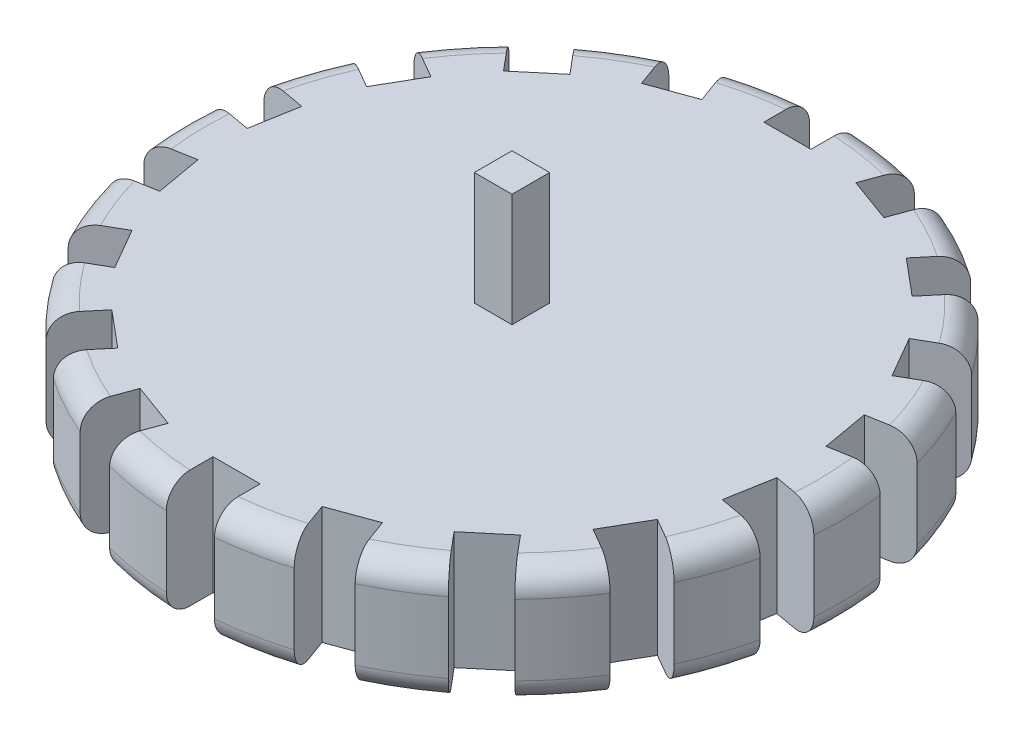
from build123d import *

# Parameters (mm, degrees)
SKETCH_1_R          = 7
EXTRUDE_1_DEPTH     = 2.5
SKETCH_2_W          = 0.8
SKETCH_2_H          = 0.8
EXTRUDE_2_DEPTH     = 2.4
SKETCH_3_R          = 1
EXTRUDE_3_DEPTH     = 1
FILLET_2_R          = 0.5
SKETCH_4_W          = 1
SKETCH_4_H          = 2
CUT_EXTRUDE_1_DEPTH = 10


with BuildPart() as part:
    # 草图1 → 凸台-拉伸1 (new body)
    with BuildSketch(Plane(origin=(0, 0, 0), x_dir=(1, 0, 0), z_dir=(0, 1, 0))):
        with Locations(Location((-28.569838241, 1.786718145, 0), (0, 0, 270))):
            Circle(SKETCH_1_R)
    extrude(amount=EXTRUDE_1_DEPTH)

    # 草图2 → 凸台-拉伸2 (add)
    with BuildSketch(Plane(origin=(0, 2.5, 0), x_dir=(1, 0, 0), z_dir=(0, 1, 0))):
        with Locations((-28.569838241, 1.786718145)):
            Rectangle(SKETCH_2_W, SKETCH_2_H)
    extrude(amount=EXTRUDE_2_DEPTH)

    # 草图3 → 凸台-拉伸3 (add)
    with BuildSketch(Plane.XZ):
        with Locations(Location((-28.569838241, -1.786718145, 0), (0, 0, 90))):
            Circle(SKETCH_3_R)
    extrude(amount=EXTRUDE_3_DEPTH)

    # 圆角2
    fillet_2_edges = [part.edges().sort_by_distance(p)[0] for p in [
        (-28.569838241, 0, -8.786718145),
        (-28.569838241, 2.5, -8.786718145),
    ]]
    fillet(fillet_2_edges, radius=FILLET_2_R)

    # 草图4 → 切除-拉伸1 (cut)
    with BuildSketch(Plane(origin=(0, 2.5, 0), x_dir=(1, 0, 0), z_dir=(0, 1, 0))):
        with Locations((-28.417730855, -5.213281855)):
            Rectangle(SKETCH_4_W, SKETCH_4_H)
        Polygon((-30.948871223, -3.732451299), (-31.632911509, -5.61183654), (-30.693218889, -5.953856683), (-30.009178602, -4.074471442), align=None)
        Polygon((-32.693065103, -2.585927453), (-33.978640322, -4.118016339), (-33.212595879, -4.760803949), (-31.927020659, -3.228715062), align=None)
        Polygon((-33.939936971, -0.911998014), (-35.671987778, -1.911998014), (-35.171987778, -2.778023418), (-33.439936971, -1.778023418), align=None)
        Polygon((-34.539095677, 1.087436422), (-36.508711183, 0.740140066), (-36.335063006, -0.244667687), (-34.3654475, 0.102628669), align=None)
        Polygon((-34.418273841, 3.171214554), (-36.387889347, 3.518510909), (-36.561537524, 2.533703156), (-34.591922018, 2.186406801), align=None)
        Polygon((-33.592044357, 5.088001986), (-35.324095165, 6.088001986), (-35.824095165, 5.221976582), (-34.092044357, 4.221976582), align=None)
        Polygon((-32.160062696, 6.606605865), (-33.445637915, 8.138694751), (-34.211682358, 7.495907141), (-32.926107139, 5.963818255), align=None)
        Polygon((-30.295046979, 7.543860151), (-30.979087266, 9.423245392), (-31.918779887, 9.081225249), (-31.2347396, 7.201840008), align=None)
        with Locations((-28.721945627, 8.786718145)):
            Rectangle(SKETCH_4_W, SKETCH_4_H)
        Polygon((-26.190805259, 7.305887588), (-25.506764973, 9.185272829), (-26.446457593, 9.527292973), (-27.13049788, 7.647907731), align=None)
        Polygon((-24.44661138, 6.159363742), (-23.16103616, 7.691452628), (-23.927080603, 8.334240238), (-25.212655823, 6.802151351), align=None)
        Polygon((-23.199739512, 4.485434303), (-21.467688704, 5.485434303), (-21.967688704, 6.351459707), (-23.699739512, 5.351459707), align=None)
        Polygon((-22.600580805, 2.485999868), (-20.630965299, 2.833296223), (-20.804613476, 3.818103976), (-22.774228982, 3.470807621), align=None)
        Polygon((-22.721402641, 0.402221736), (-20.751787135, 0.05492538), (-20.578138958, 1.039733133), (-22.547754464, 1.387029489), align=None)
        Polygon((-23.547632125, -1.514565697), (-21.815581318, -2.514565697), (-21.315581318, -1.648540293), (-23.047632125, -0.648540293), align=None)
        Polygon((-24.979613786, -3.033169576), (-23.694038567, -4.565258462), (-22.927994124, -3.922470852), (-24.213569343, -2.390381966), align=None)
        Polygon((-26.844629503, -3.970423862), (-26.160589216, -5.849809103), (-25.220896595, -5.50778896), (-25.904936882, -3.628403718), align=None)
    extrude(amount=-CUT_EXTRUDE_1_DEPTH, mode=Mode.SUBTRACT)


solid = part.part
